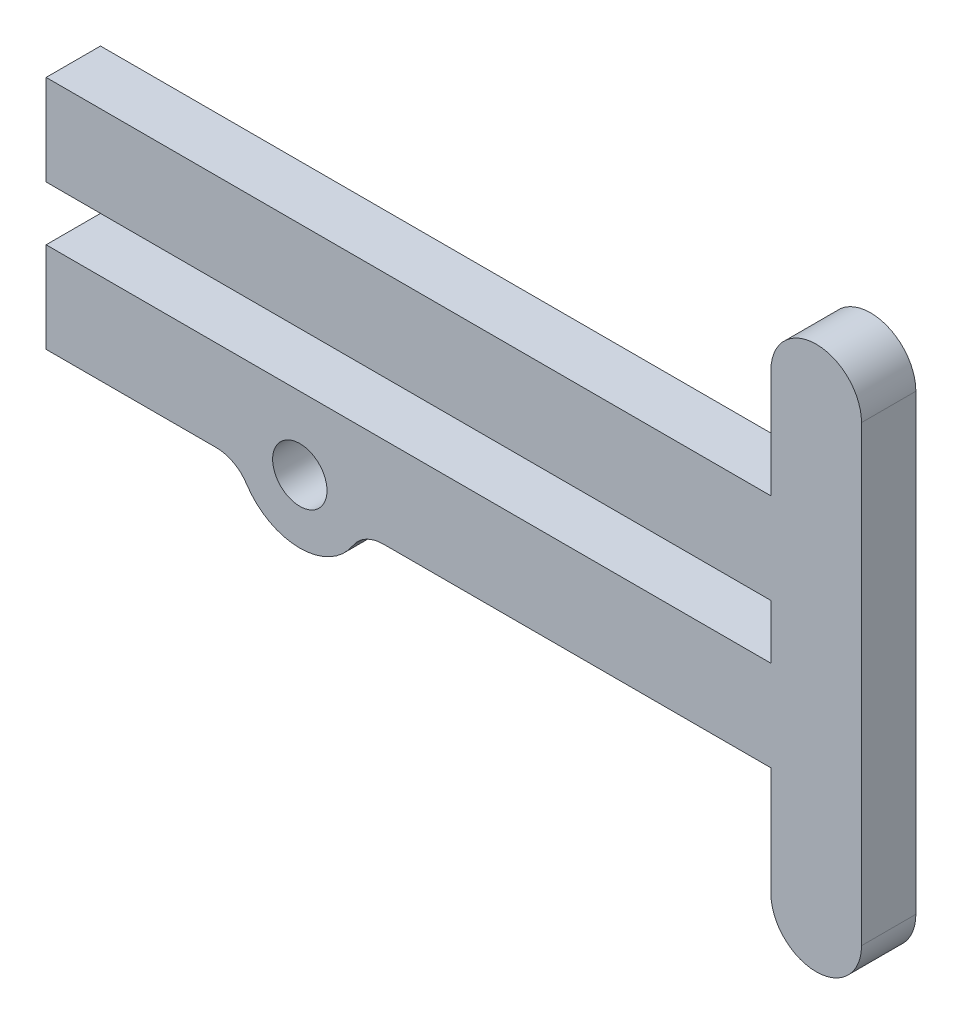
from build123d import *

# Parameters (mm, degrees)
EXTRUDE_1_DEPTH     = 3
SKETCH_2_R          = 3.5
EXTRUDE_2_DEPTH     = 3
SKETCH_3_R          = 1.5
CUT_EXTRUDE_1_DEPTH = 48.689097286
EXTRUDE_3_DEPTH     = 3
FILLET_1_R          = 2


with BuildPart() as part:
    # 草图1 → 凸台-拉伸1 (new body)
    with BuildSketch(Plane.XY):
        Polygon((-45, 0), (0, 0), (0, -13), (-45, -13), (-45, -8), (-5, -8), (-5, -5), (-45, -5), align=None)
    extrude(amount=EXTRUDE_1_DEPTH)

    # 草图2 → 凸台-拉伸2 (add)
    with BuildSketch(Plane.XY.offset(3)):
        with Locations((-31, -12)):
            Circle(SKETCH_2_R)
    extrude(amount=-EXTRUDE_2_DEPTH)

    # 草图3 → 切除-拉伸1 (cut, through all)
    with BuildSketch(Plane.XY.offset(3)):
        with Locations((-31, -12)):
            Circle(SKETCH_3_R)
    extrude(amount=-CUT_EXTRUDE_1_DEPTH, mode=Mode.SUBTRACT)

    # 草图4 → 凸台-拉伸3 (add)
    with BuildSketch(Plane.XY):
        with BuildLine():
            Line((0, 6), (0, -19))
            ThreePointArc((0, -19), (-2.5, -21.5), (-5, -19))
            Line((-5, -19), (-5, 6))
            ThreePointArc((-5, 6), (-2.5, 8.5), (0, 6))
        make_face()
    extrude(amount=EXTRUDE_3_DEPTH)

    # 圆角1
    fillet_1_edges = [part.edges().sort_by_distance(p)[0] for p in [
        (-34.354101966, -13, 1.5),
        (-27.645898034, -13, 1.5),
    ]]
    fillet(fillet_1_edges, radius=FILLET_1_R)


solid = part.part
